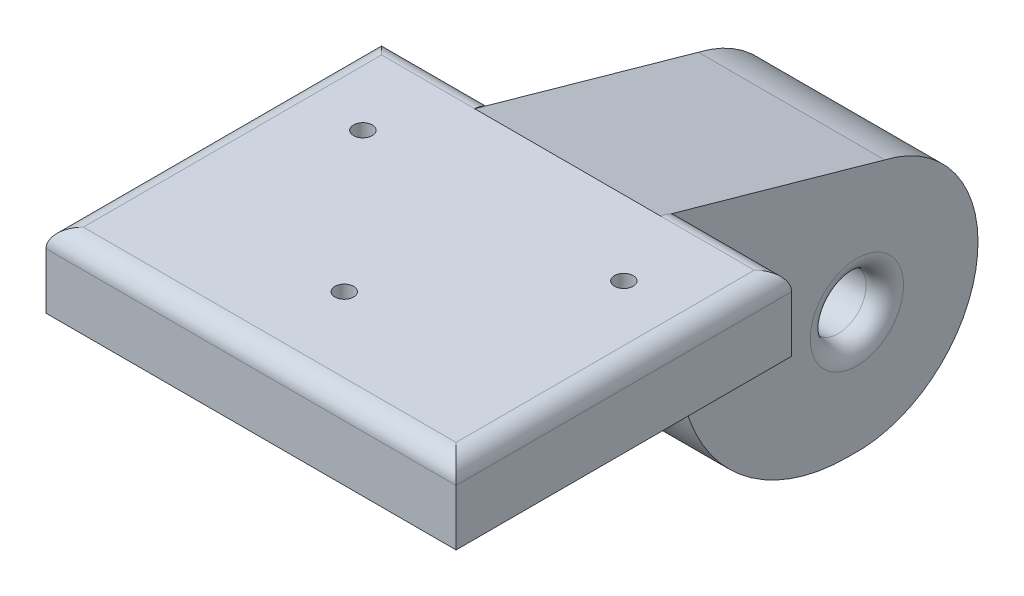
from build123d import *

# Parameters (mm, degrees)
SKETCH1_W           = 11
SKETCH1_H           = 18
SKETCH1_W_2         = 5
SKETCH1_H_2         = 11
BOSS_EXTRUDE1_DEPTH = 4
BOSS_EXTRUDE2_DEPTH = 5
SKETCH3_R           = 0.5
CUT_EXTRUDE1_DEPTH  = 5
FILLET1_R           = 1
FILLET3_R           = 2
FILLET4_R           = 9
CUT_EXTRUDE2_DEPTH  = 10


with BuildPart() as part:
    # Sketch1 → Boss-Extrude1 (new body)
    with BuildSketch(Plane(origin=(0, 0, 0), x_dir=(1, 0, 0), z_dir=(0, 1, 0))):
        with Locations((-2.740875912, 16.357664234)):
            Rectangle(SKETCH1_W, SKETCH1_H)
        with Locations((-5.740875912, 30.857664234)):
            Rectangle(SKETCH1_W_2, SKETCH1_H_2)
    boss_extrude1 = extrude(amount=BOSS_EXTRUDE1_DEPTH)

    # Sketch2 → Boss-Extrude2 (add)
    with BuildSketch(Plane(origin=(-3.240875912, 0, 0), x_dir=(0, 0, -1), z_dir=(1, 0, 0))):
        with BuildLine():
            Line((34.537911903, 0), (25.357664234, 0))
            Line((25.357664234, 0), (25.357664234, -12.192130501))
            Line((25.357664234, -12.192130501), (34.537911903, -12.192130501))
            Line((34.537911903, -12.192130501), (34.537911903, -7.165523267))
            ThreePointArc((34.537911903, -7.165523267), (33.357664234, -5.7), (34.537911903, -4.234476733))
            Line((34.537911903, -4.234476733), (34.537911903, 0))
        make_face()
        with BuildLine():
            Line((36.357664234, 0), (34.537911903, 0))
            Line((34.537911903, 0), (34.537911903, -4.234476733))
            ThreePointArc((34.537911903, -4.234476733), (35.798507341, -4.531747353), (36.357664234, -5.7))
            ThreePointArc((36.357664234, -5.7), (35.798507341, -6.868252647), (34.537911903, -7.165523267))
            Line((34.537911903, -7.165523267), (34.537911903, -12.192130501))
            ThreePointArc((34.537911903, -12.192130501), (41.293121094, -6.613725887), (36.357664234, 0.62455532))
            Line((36.357664234, 0.62455532), (36.357664234, 0))
        make_face()
    boss_extrude2 = extrude(amount=-BOSS_EXTRUDE2_DEPTH)

    # Mirror1: Boss-Extrude1, Boss-Extrude2 across plane
    add(boss_extrude1.mirror(Plane(origin=(-8.240875912, 4, 0), x_dir=(0, 0, 1), z_dir=(1, 0, 0))))
    add(boss_extrude2.mirror(Plane(origin=(-8.240875912, 4, 0), x_dir=(0, 0, 1), z_dir=(1, 0, 0))))

    # Sketch3 → Cut-Extrude1 (cut)
    with BuildSketch(Plane(origin=(0, 4, 0), x_dir=(1, 0, 0), z_dir=(0, 1, 0))):
        with Locations(Location((-1.240875912, 20.357664234, 0), (0, 0, 270))):
            Circle(SKETCH3_R)
        with Locations(Location((-8.240875912, 12.357664234, 0), (0, 0, 270))):
            Circle(SKETCH3_R)
        with Locations(Location((-15.240875912, 20.357664234, 0), (0, 0, 270))):
            Circle(SKETCH3_R)
    extrude(amount=-CUT_EXTRUDE1_DEPTH, mode=Mode.SUBTRACT)

    # Fillet1
    fillet1_edges = [part.edges().sort_by_distance(p)[0] for p in [
        (-0.240875912, 4, -25.357664234),
        (-3.240875912, -4.234476733, -35.177416564),
        (-8.240875912, 4, -7.357664234),
        (-19.240875912, 4, -16.357664234),
        (-16.240875912, 4, -25.357664234),
        (2.759124088, 4, -16.357664234),
        (-13.240875912, -4.234476733, -35.177416564),
    ]]
    fillet(fillet1_edges, radius=FILLET1_R)

    # Fillet3
    fillet3_edges = [part.edges().sort_by_distance(p)[0] for p in [
        (-8.240875912, 0, -25.357664234),
    ]]
    fillet(fillet3_edges, radius=FILLET3_R)

    # Fillet4
    fillet4_edges = [part.edges().sort_by_distance(p)[0] for p in [
        (-8.240875912, -12.192130501, -25.357664234),
    ]]
    fillet(fillet4_edges, radius=FILLET4_R)

    # Sketch4 → Cut-Extrude2 (cut)
    with BuildSketch(Plane.ZY.offset(13.240875912)):
        Polygon((-36.357664234, 0.62455532), (-24.357664234, 4), (-36.357664234, 4), align=None)
    extrude(amount=-CUT_EXTRUDE2_DEPTH, mode=Mode.SUBTRACT)


solid = part.part
